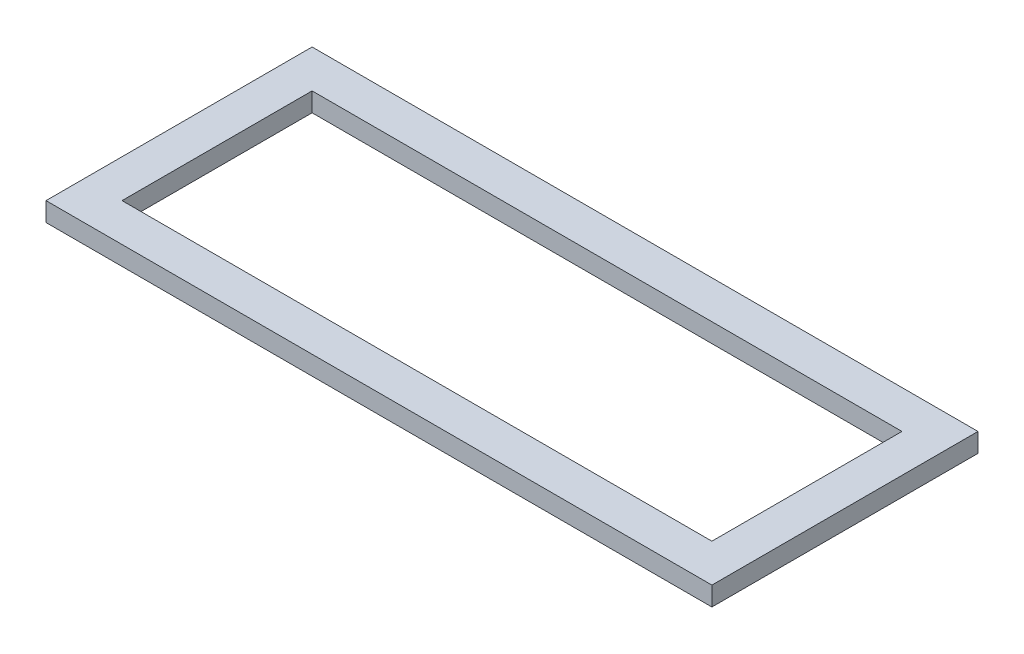
from build123d import *

# Parameters (mm, degrees)
SKETCH1_W           = 508
SKETCH1_H           = 203
SKETCH1_W_2         = 450
SKETCH1_H_2         = 145
BOSS_EXTRUDE1_DEPTH = 14.5


with BuildPart() as part:
    # Sketch1 → Boss-Extrude1 (new body)
    with BuildSketch(Plane(origin=(0, 0, 0), x_dir=(1, 0, 0), z_dir=(0, 1, 0))):
        with Locations((-254, -101.5)):
            Rectangle(SKETCH1_W, SKETCH1_H)
        with Locations((-254, -101.5)):
            Rectangle(SKETCH1_W_2, SKETCH1_H_2, mode=Mode.SUBTRACT)
    extrude(amount=BOSS_EXTRUDE1_DEPTH)


solid = part.part
